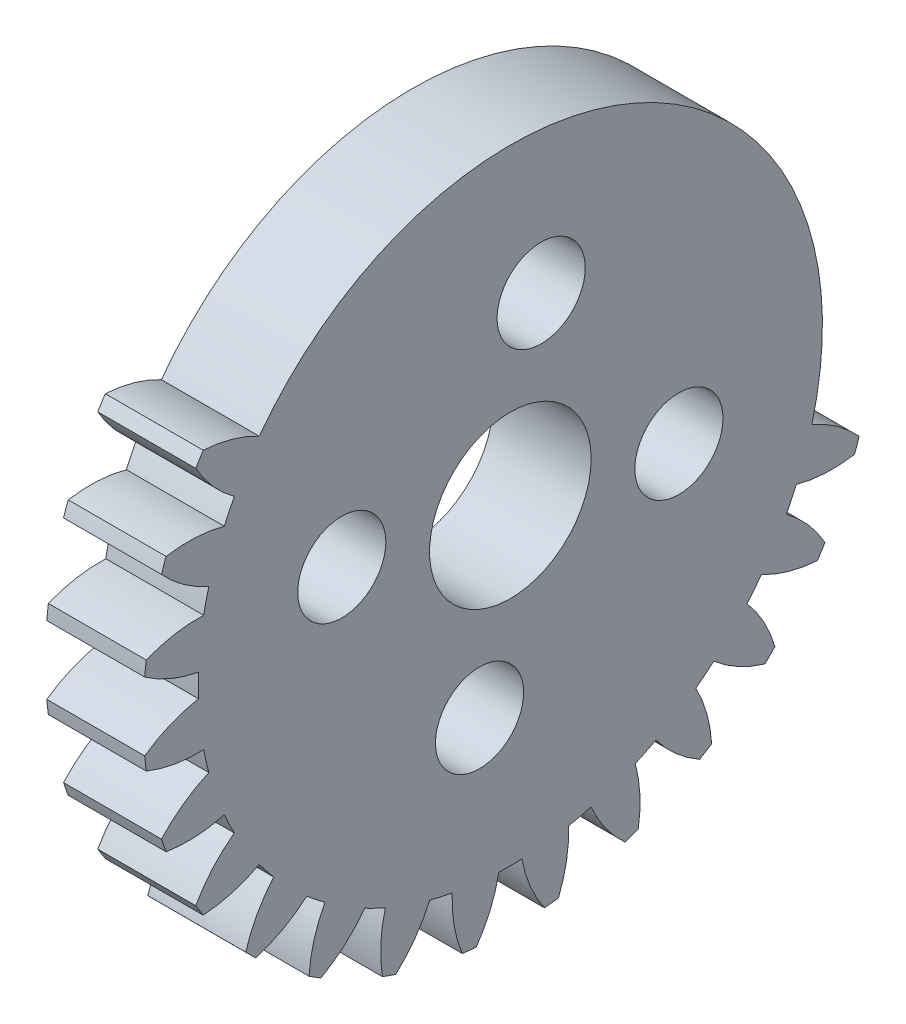
from build123d import *
from build123d.topology import SkipClean

# Parameters (mm, degrees)
BASPROSKE_W         = 10
BASPROSKE_H         = 15
TOOTHCUT_DEPTH      = 24.452078799
TEETHCUTS_COUNT     = 28
TEETHCUTS_ANGLE     = 347.142857143
BORSKE_R            = 3.3
BORE_DEPTH          = 50.0000508
SKETCH_1_R          = 15
CUT_EXTRUDE_1_DEPTH = 6
CUT_EXTRUDE_2_DEPTH = 10
SKETCH_3_R          = 1.8
CUT_EXTRUDE_3_DEPTH = 10


with BuildPart() as part:
    # BasProSke → Base-Revolve (revolve)
    with BuildSketch(Plane(origin=(0, 0, 0), x_dir=(1, 0, 0), z_dir=(0, 1, 0)), mode=Mode.PRIVATE) as base_revolve_sk:
        with Locations((5, 7.5)):
            Rectangle(BASPROSKE_W, BASPROSKE_H)
    revolve(base_revolve_sk.sketch.rotate(Axis((-10, 0, 0), (1, 0, 0)), 180), axis=Axis((-10, 0, 0), (1, 0, 0)))

    # TooCutSke → ToothCut (cut, through all)
    with BuildSketch(Plane(origin=(0, 0, 0), x_dir=(0, 0, -1), z_dir=(1, 0, 0))):
        with BuildLine():
            ThreePointArc((0.471336039, 12.740284272), (0, 12.749), (-0.471336039, 12.740284272))
            ThreePointArc((-0.471336039, 12.740284272), (-0.81983923, 13.900763331), (-1.409805137, 14.959114099))
            ThreePointArc((-1.409805137, 14.959114099), (0, 15.0254), (1.409805137, 14.959114099))
            ThreePointArc((1.409805137, 14.959114099), (0.81983923, 13.900763331), (0.471336039, 12.740284272))
        make_face()
    toothcut = extrude(amount=TOOTHCUT_DEPTH, mode=Mode.SUBTRACT)

    # TeethCuts: ToothCut ×28 about axis
    teethcuts_axis = Axis((-10, 0, 0), (1, 0, 0))
    for i in range(1, TEETHCUTS_COUNT):
        add(toothcut.rotate(teethcuts_axis, i * TEETHCUTS_ANGLE / (TEETHCUTS_COUNT - 1)), mode=Mode.SUBTRACT)

    # BorSke → Bore (cut, symmetric)
    with BuildSketch(Plane(origin=(0, 0, 0), x_dir=(0, 0, -1), z_dir=(1, 0, 0))):
        with Locations(Location((0, 0, 0), (0, 0, 180))):
            Circle(BORSKE_R)
    extrude(amount=BORE_DEPTH, both=True, mode=Mode.SUBTRACT)

    # ｽｹｯﾁ1 → ｶｯﾄ - 押し出し1 (cut)
    with BuildSketch(Plane(origin=(10, 0, 0), x_dir=(0, 0, -1), z_dir=(1, 0, 0))):
        Circle(SKETCH_1_R)
    extrude(amount=-CUT_EXTRUDE_1_DEPTH, mode=Mode.SUBTRACT)

    # ｽｹｯﾁ2 → ｶｯﾄ - 押し出し2 (cut)
    with SkipClean():  # the faces are left unmerged after this step: merging them gives an invalid solid
        with BuildSketch(Plane.ZY):
            with BuildLine():
                Line((-12.525740882, -2.375461295), (-14.737321612, -2.794879553))
                ThreePointArc((-14.737321612, -2.794879553), (-6.004168657, 13.745906981), (12.065215177, 8.912383672))
                Line((12.065215177, 8.912383672), (10.254628553, 7.574931963))
                ThreePointArc((10.254628553, 7.574931963), (-5.10314308, 11.68310454), (-12.525740882, -2.375461295))
            make_face()
        extrude(amount=-CUT_EXTRUDE_2_DEPTH, mode=Mode.SUBTRACT)

    # ｽｹｯﾁ3 → ｶｯﾄ - 押し出し3 (cut)
    with SkipClean():  # the faces are left unmerged after this step: merging them gives an invalid solid
        with BuildSketch(Plane(origin=(4, 0, 0), x_dir=(0, 0, -1), z_dir=(1, 0, 0))):
            with Locations((-6.885831114, 1.259098832)):
                Circle(SKETCH_3_R)
            with Locations((1.259098832, 6.885831114)):
                Circle(SKETCH_3_R)
            with Locations((6.885831114, -1.259098832)):
                Circle(SKETCH_3_R)
            with Locations((-1.259098832, -6.885831114)):
                Circle(SKETCH_3_R)
        extrude(amount=-CUT_EXTRUDE_3_DEPTH, mode=Mode.SUBTRACT)


solid = part.part
